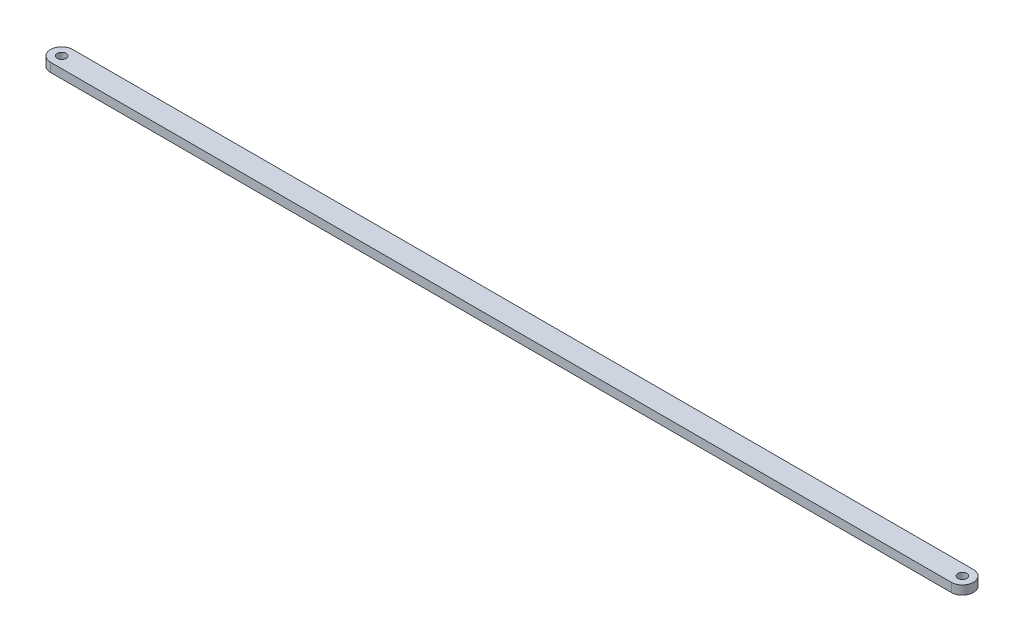
from build123d import *

# Parameters (mm, degrees)
SKETCH1_R           = 2
BOSS_EXTRUDE1_DEPTH = 2


with BuildPart() as part:
    # Sketch1 → Boss-Extrude1 (new, symmetric)
    with BuildSketch(Plane(origin=(0, 0, 0), x_dir=(1, 0, 0), z_dir=(0, 1, 0))):
        with BuildLine():
            Line((-203.5, 5), (203.5, 5))
            ThreePointArc((203.5, 5), (208.5, 0), (203.5, -5))
            Line((203.5, -5), (-203.5, -5))
            ThreePointArc((-203.5, -5), (-208.5, 0), (-203.5, 5))
        make_face()
        with Locations(Location((203.5, 0, 0), (0, 0, 270))):
            Circle(SKETCH1_R, mode=Mode.SUBTRACT)
        with Locations(Location((-203.5, 0, 0), (0, 0, 90))):
            Circle(SKETCH1_R, mode=Mode.SUBTRACT)
    extrude(amount=BOSS_EXTRUDE1_DEPTH, both=True)


solid = part.part
